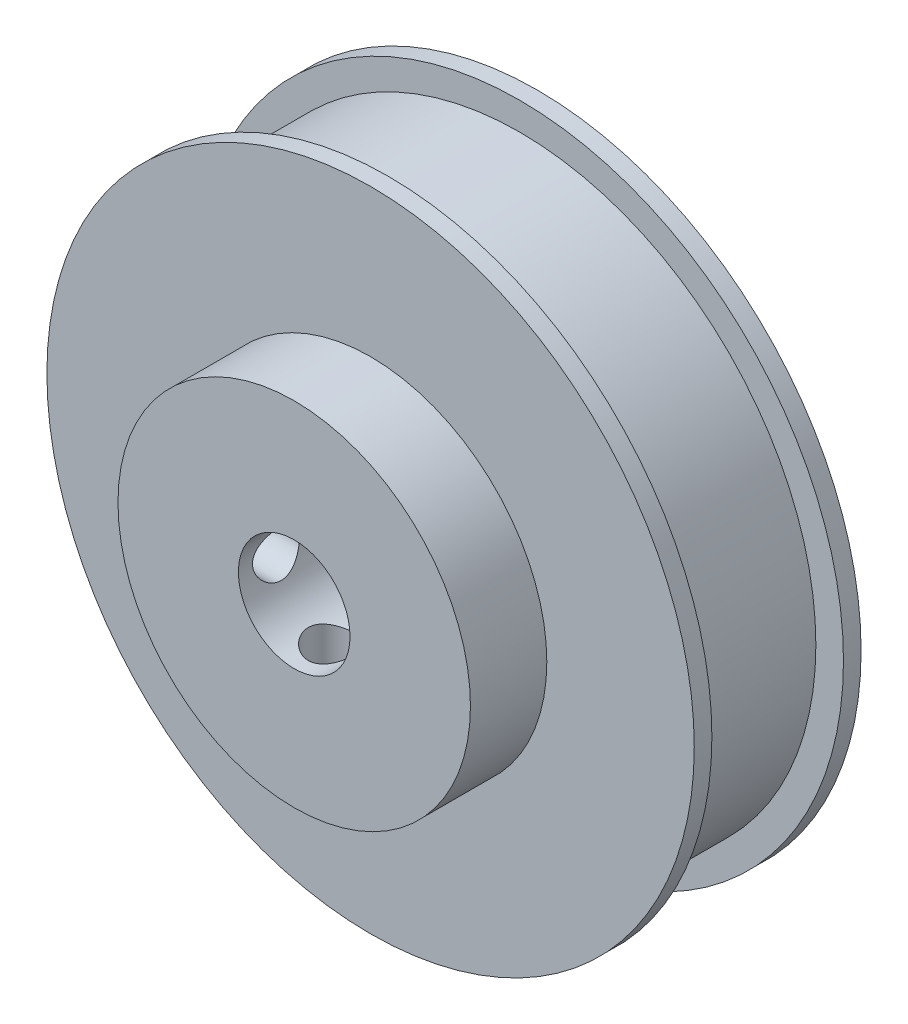
from build123d import *

# Parameters (mm, degrees)
CROQUIS1_R              = 27.55
SALIENTE_EXTRUIR1_DEPTH = 1.5
CROQUIS2_R              = 25.2
SALIENTE_EXTRUIR2_DEPTH = 11.2
CROQUIS3_R              = 27.55
SALIENTE_EXTRUIR3_DEPTH = 1.5
CROQUIS8_R              = 15
SALIENTE_EXTRUIR5_DEPTH = 6.5
CROQUIS6_R              = 2
CORTAR_EXTRUIR3_DEPTH   = 45.119100172
CROQUIS5_R              = 2
CORTAR_EXTRUIR2_DEPTH   = 45.119100219
CROQUIS4_R              = 4.75
CORTAR_EXTRUIR1_DEPTH   = 45.119100172


with BuildPart() as part:
    # Croquis1 → Saliente-Extruir1 (new body)
    with BuildSketch(Plane.XY):
        Circle(CROQUIS1_R)
    extrude(amount=SALIENTE_EXTRUIR1_DEPTH)

    # Croquis2 → Saliente-Extruir2 (add)
    with BuildSketch(Plane.XY.offset(1.5)):
        Circle(CROQUIS2_R)
    extrude(amount=SALIENTE_EXTRUIR2_DEPTH)

    # Croquis3 → Saliente-Extruir3 (add)
    with BuildSketch(Plane.XY.offset(12.7)):
        Circle(CROQUIS3_R)
    extrude(amount=SALIENTE_EXTRUIR3_DEPTH)

    # Croquis8 → Saliente-Extruir5 (add)
    with BuildSketch(Plane.XY.offset(14.2)):
        with Locations(Location((0, 0, 0), (0, 0, 180))):
            Circle(CROQUIS8_R)
    extrude(amount=SALIENTE_EXTRUIR5_DEPTH)

    # Croquis6 → Cortar-Extruir3 (cut, through all)
    with BuildSketch(Plane(origin=(0, 0, 0), x_dir=(1, 0, 0), z_dir=(0, 1, 0))):
        with Locations(Location((0, -17.5, 0), (0, 0, 270))):
            Circle(CROQUIS6_R)
    extrude(amount=-CORTAR_EXTRUIR3_DEPTH, mode=Mode.SUBTRACT)

    # Croquis5 → Cortar-Extruir2 (cut, through all)
    with BuildSketch(Plane(origin=(0, 0, 0), x_dir=(0, 0, -1), z_dir=(1, 0, 0))):
        with Locations(Location((-17.5, 0, 0), (0, 0, 180))):
            Circle(CROQUIS5_R)
    extrude(amount=-CORTAR_EXTRUIR2_DEPTH, mode=Mode.SUBTRACT)

    # Croquis4 → Cortar-Extruir1 (cut, through all)
    with BuildSketch(Plane.XY.offset(20.7)):
        Circle(CROQUIS4_R)
    extrude(amount=-CORTAR_EXTRUIR1_DEPTH, mode=Mode.SUBTRACT)


solid = part.part
